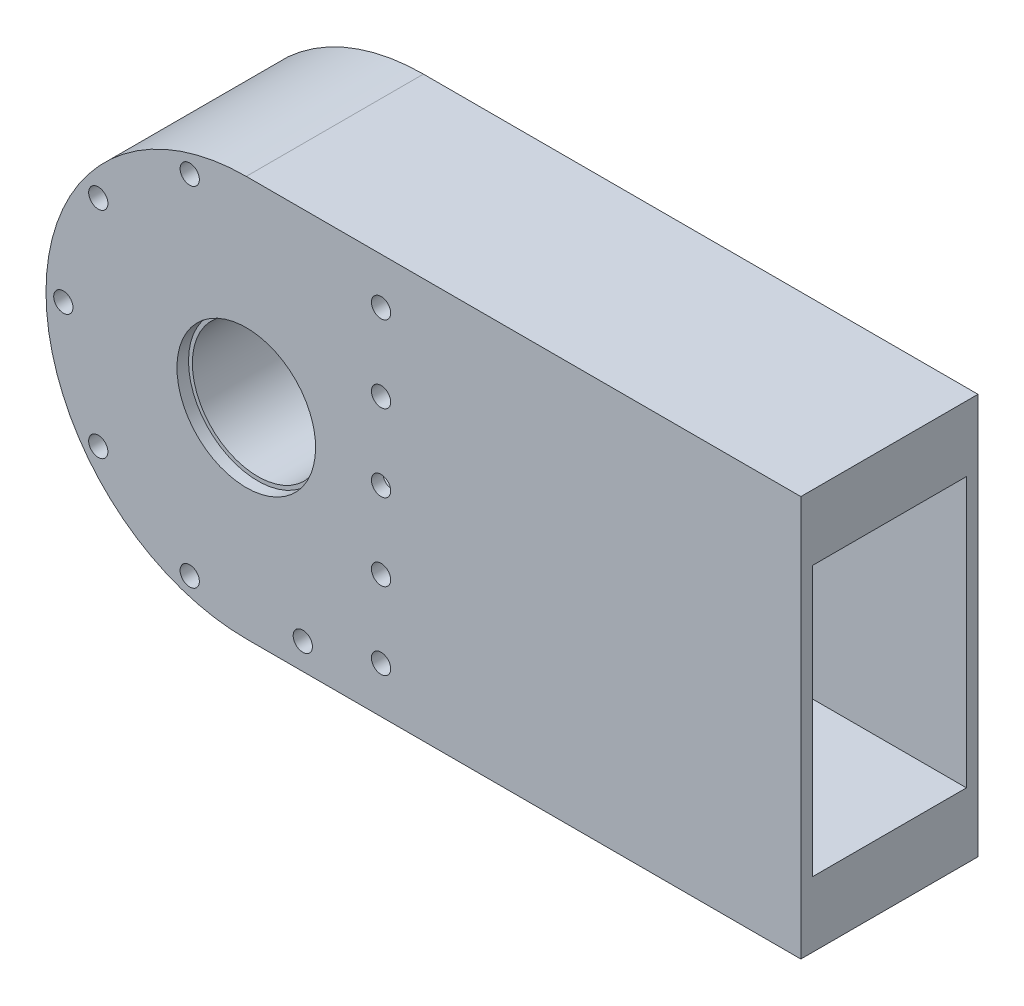
from build123d import *

# Parameters (mm, degrees)
SALIENTE_EXTRUIR1_DEPTH = 40
CROQUIS4_R              = 18
SALIENTE_EXTRUIR2_DEPTH = 3
SALIENTE_EXTRUIR3_START = 3
SALIENTE_EXTRUIR3_DEPTH = 3
CROQUIS6_R              = 2.5
CORTAR_EXTRUIR1_DEPTH   = 10
CROQUIS7_R              = 2.5
CORTAR_EXTRUIR2_DEPTH   = 25


with BuildPart() as part:
    # Croquis2 → Saliente-Extruir1 (new body)
    with BuildSketch(Plane.XY):
        with BuildLine():
            Line((144, 52), (0, 52))
            ThreePointArc((0, 52), (-52, 0), (0, -52))
            Line((0, -52), (144, -52))
            Line((144, -52), (144, -35))
            Line((144, -35), (40, -35))
            Line((40, -35), (40, -5))
            Line((40, -5), (16.248076809, -5))
            ThreePointArc((16.248076809, -5), (-17, 0), (16.248076809, 5))
            Line((16.248076809, 5), (40, 5))
            Line((40, 5), (40, 35))
            Line((40, 35), (144, 35))
            Line((144, 35), (144, 52))
        make_face()
    extrude(amount=SALIENTE_EXTRUIR1_DEPTH)

    # Croquis4 → Saliente-Extruir2 (add)
    with BuildSketch(Plane.XY.offset(40)):
        with BuildLine():
            Line((144, 52), (144, -52))
            Line((144, -52), (0, -52))
            ThreePointArc((0, -52), (-52, 0), (0, 52))
            Line((0, 52), (144, 52))
        make_face()
        with Locations(Location((0, 0, 0), (0, 0, 16.127620213))):
            Circle(CROQUIS4_R, mode=Mode.SUBTRACT)
    extrude(amount=SALIENTE_EXTRUIR2_DEPTH)

    # Croquis5 → Saliente-Extruir3 (add)
    with BuildSketch(Plane(origin=(0, 0, 0), x_dir=(-1, 0, 0), z_dir=(0, 0, -1)).offset(SALIENTE_EXTRUIR3_START)):
        with BuildLine():
            Line((0, -52), (-144, -52))
            Line((-144, -52), (-144, 52))
            Line((-144, 52), (0, 52))
            ThreePointArc((0, 52), (52, 0), (0, -52))
        make_face()
    extrude(amount=-SALIENTE_EXTRUIR3_DEPTH)

    # Croquis6 → Cortar-Extruir1 (cut)
    with BuildSketch(Plane(origin=(0, 0, -3), x_dir=(-1, 0, 0), z_dir=(0, 0, -1))):
        with Locations((-135, 42.5)):
            Circle(CROQUIS6_R)
        with Locations(Location((-9, 42.5, 0), (0, 0, 180))):
            Circle(CROQUIS6_R)
        with Locations((-9, -42.5)):
            Circle(CROQUIS6_R)
        with Locations(Location((-135, -42.5, 0), (0, 0, 180))):
            Circle(CROQUIS6_R)
        with Locations((45, 0)):
            Circle(CROQUIS6_R)
    extrude(amount=-CORTAR_EXTRUIR1_DEPTH, mode=Mode.SUBTRACT)

    # Croquis7 → Cortar-Extruir2 (cut)
    with BuildSketch(Plane.XY.offset(43)):
        with Locations((35, 0)):
            Circle(CROQUIS7_R)
        with Locations((35, 20)):
            Circle(CROQUIS7_R)
        with Locations((35, 40)):
            Circle(CROQUIS7_R)
        with Locations(Location((35, -40, 0), (0, 0, 180))):
            Circle(CROQUIS7_R)
        with Locations(Location((35, -20, 0), (0, 0, 180))):
            Circle(CROQUIS7_R)
        with Locations((-14.678307233, 45.175184524)):
            Circle(CROQUIS7_R)
        with Locations((-38.428307233, 27.919799484)):
            Circle(CROQUIS7_R)
        with Locations((-47.5, 0)):
            Circle(CROQUIS7_R)
        with Locations((-38.428307233, -27.919799484)):
            Circle(CROQUIS7_R)
        with Locations((-14.678307233, -45.175184524)):
            Circle(CROQUIS7_R)
        with Locations((14.678307233, -45.175184524)):
            Circle(CROQUIS7_R)
    extrude(amount=-CORTAR_EXTRUIR2_DEPTH, mode=Mode.SUBTRACT)


solid = part.part
